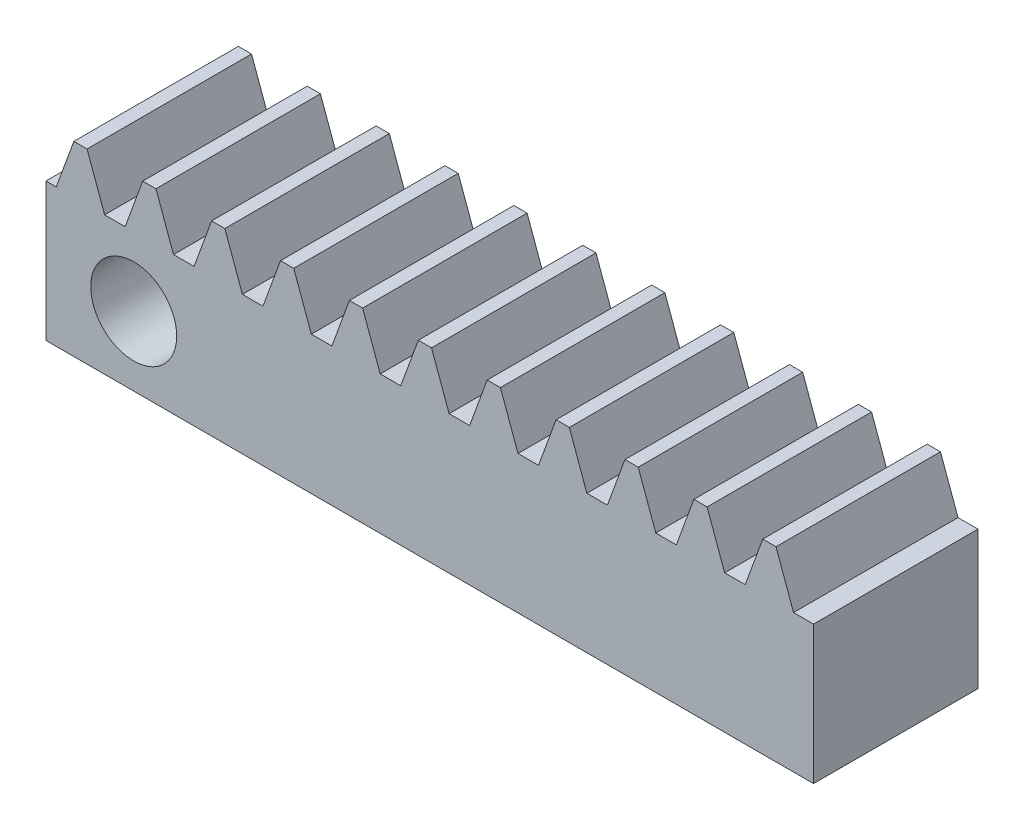
from build123d import *

# Parameters (mm, degrees)
BLANKSKE_W         = 44.45
BLANKSKE_H         = 10.795
BLANK_DEPTH        = 9.525
TOOTHCUTSIM_DEPTH  = 47.723229233
TEETHCUTS_COUNT    = 12
TEETHCUTS_PITCH    = 3.989822666
SKETCH1_R          = 2.4892
CUT_EXTRUDE1_DEPTH = 14.478


with BuildPart() as part:
    # BlankSke → Blank (new body)
    with BuildSketch(Plane.XY):
        with Locations((22.225, 5.3975)):
            Rectangle(BLANKSKE_W, BLANKSKE_H)
    extrude(amount=-BLANK_DEPTH)

    # TooCutSkeSim → ToothCutSim (cut, through all)
    with BuildSketch(Plane.XY):
        Polygon((0.595165029, 8.001), (-0.595165029, 8.001), (-1.621342708, 10.8204), (1.621342708, 10.8204), align=None)
    toothcutsim = extrude(amount=-TOOTHCUTSIM_DEPTH, mode=Mode.SUBTRACT)

    # TeethCuts: ToothCutSim ×12
    with Locations(*[(i * TEETHCUTS_PITCH, 0, 0) for i in range(1, TEETHCUTS_COUNT)]):
        add(toothcutsim, mode=Mode.SUBTRACT)

    # Sketch1 → Cut-Extrude1 (cut)
    with BuildSketch(Plane.XY):
        with Locations((5.08, 4.0005)):
            Circle(SKETCH1_R)
    extrude(amount=-CUT_EXTRUDE1_DEPTH, mode=Mode.SUBTRACT)


solid = part.part
